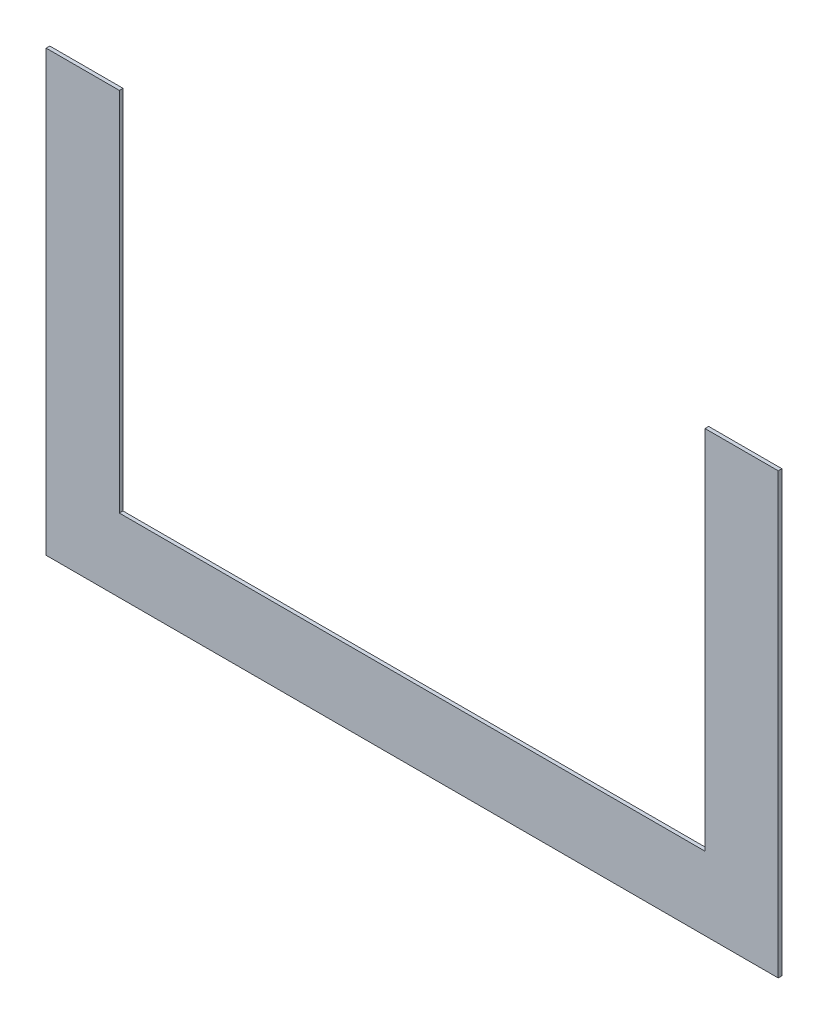
from build123d import *

# Parameters (mm, degrees)
BOSS_EXTRUDE1_DEPTH = 2.54


with BuildPart() as part:
    # Sketch2 → Boss-Extrude1 (new body)
    with BuildSketch(Plane.XY):
        Polygon((-240.483025281, 47.18729168), (165.916974719, 47.18729168), (165.916974719, 301.18729168), (216.716974719, 301.18729168), (216.716974719, -3.61270832), (165.916974719, -3.61270832), (-240.483025281, -3.61270832), (-291.283025281, -3.61270832), (-291.283025281, 301.18729168), (-240.483025281, 301.18729168), align=None)
    extrude(amount=BOSS_EXTRUDE1_DEPTH)


solid = part.part
